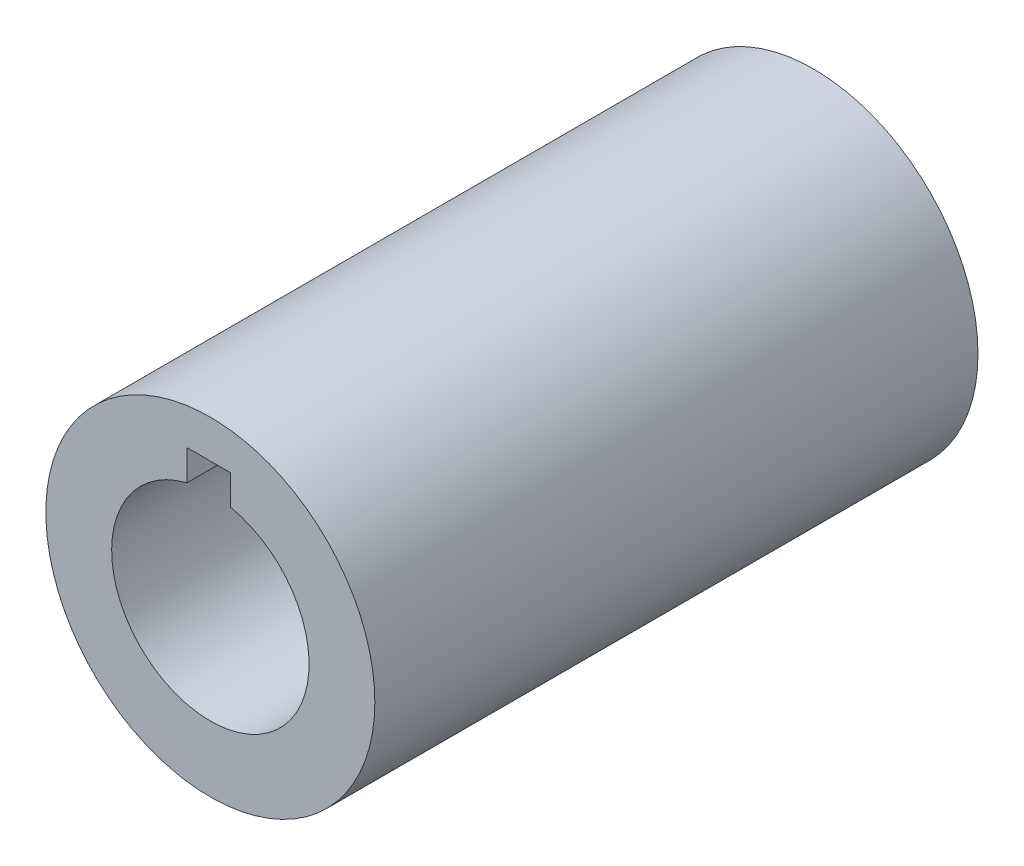
from build123d import *

# Parameters (mm, degrees)
SKETCH1_R           = 15
BOSS_EXTRUDE1_DEPTH = 55


with BuildPart() as part:
    # Sketch1 → Boss-Extrude1 (new body)
    with BuildSketch(Plane.XY):
        with Locations((0.142780768, -8.511321707)):
            Circle(SKETCH1_R)
        with BuildLine():
            Line((2, 3.016416073), (-2, 3.016416073))
            Line((-2, 3.016416073), (-2, 0.229873324))
            ThreePointArc((-2, 0.229873324), (0.289224182, -17.510130202), (2, 0.294967904))
            Line((2, 0.294967904), (2, 3.016416073))
        make_face(mode=Mode.SUBTRACT)
    extrude(amount=BOSS_EXTRUDE1_DEPTH)


solid = part.part
